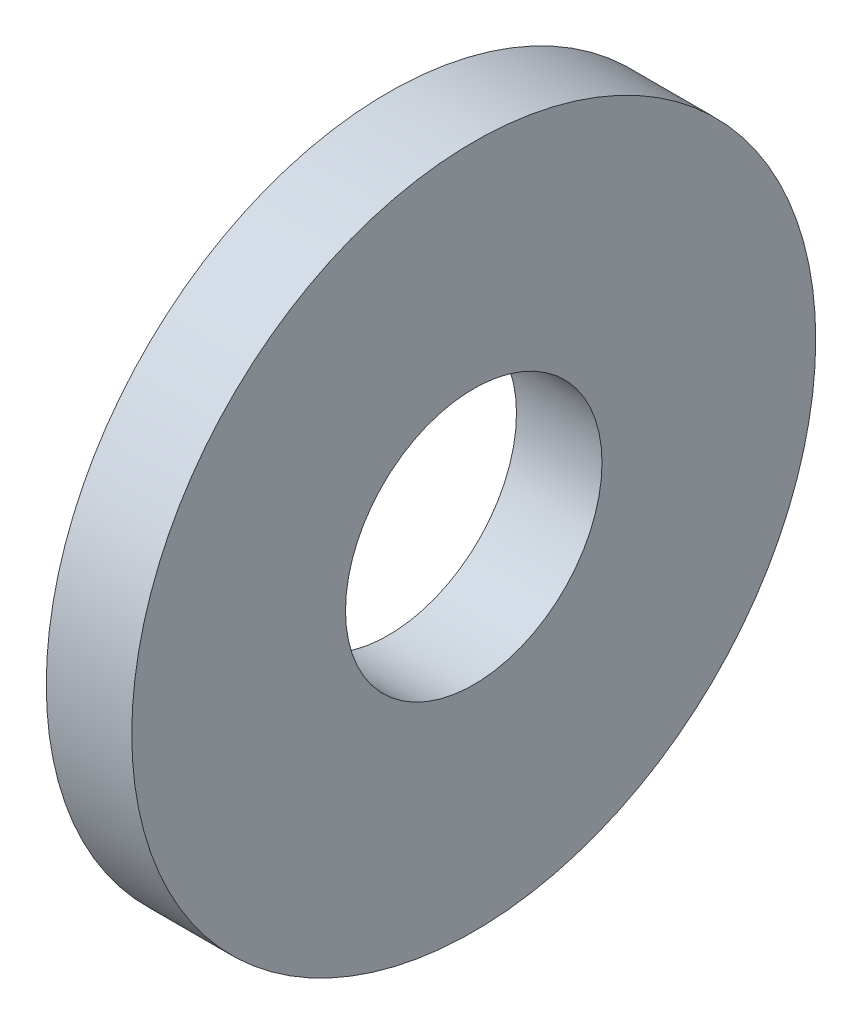
from build123d import *

# Parameters (mm, degrees)
SKETCH1_R          = 4
SKETCH1_R_2        = 1.5
BASE_EXTRUDE_DEPTH = 1


with BuildPart() as part:
    # Sketch1 → Base-Extrude (new body)
    with BuildSketch(Plane(origin=(0, 0, 0), x_dir=(0, 0, -1), z_dir=(1, 0, 0))):
        Circle(SKETCH1_R)
        Circle(SKETCH1_R_2, mode=Mode.SUBTRACT)
    extrude(amount=BASE_EXTRUDE_DEPTH)


solid = part.part
